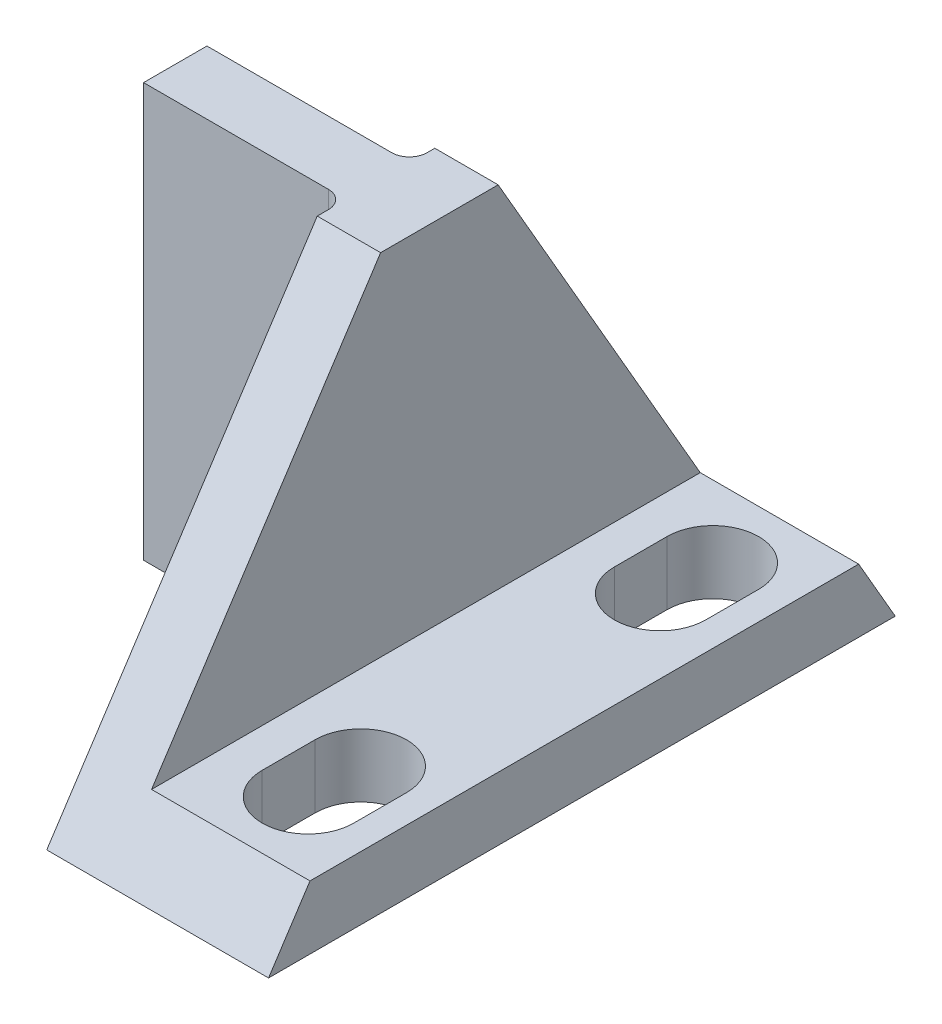
from build123d import *

# Parameters (mm, degrees)
SKETCH1_W           = 14.605
SKETCH1_H           = 33.02
BOSS_EXTRUDE1_DEPTH = 4.572
BOSS_EXTRUDE2_DEPTH = 4.572
BOSS_EXTRUDE3_DEPTH = 11.43
CUT_EXTRUDE1_DEPTH  = 50.300379278
SKETCH5_R           = 1.25000004
SKETCH5_R_2         = 1.25
CUT_EXTRUDE2_DEPTH  = 11.43
SKETCH6_W           = 33.355726526
SKETCH6_H           = 18.831890795
CUT_EXTRUDE3_DEPTH  = 3.175
FILLET1_R           = 1.27


with BuildPart() as part:
    # Sketch1 → Boss-Extrude1 (new body)
    with BuildSketch(Plane.XY):
        with Locations((7.3025, 16.51)):
            Rectangle(SKETCH1_W, SKETCH1_H)
    extrude(amount=BOSS_EXTRUDE1_DEPTH)

    # Sketch2 → Boss-Extrude2 (add)
    with BuildSketch(Plane(origin=(14.605, 0, 0), x_dir=(0, 0, -1), z_dir=(1, 0, 0))):
        Polygon((-4.572, 33.02), (-26.162, 0), (19.05, 0), (0, 33.02), align=None)
    extrude(amount=BOSS_EXTRUDE2_DEPTH)

    # Sketch3 → Boss-Extrude3 (add)
    with BuildSketch(Plane(origin=(19.177, 0, 0), x_dir=(0, 0, -1), z_dir=(1, 0, 0))):
        Polygon((-23.172615385, 4.572), (16.412307692, 4.572), (19.05, 0), (-26.162, 0), align=None)
    extrude(amount=BOSS_EXTRUDE3_DEPTH)

    # Sketch4 → Cut-Extrude1 (cut, through all)
    with BuildSketch(Plane(origin=(0, 4.572, 0), x_dir=(1, 0, 0), z_dir=(0, 1, 0))):
        with BuildLine():
            Line((28.575, 11.224846154), (28.575, 7.414846154))
            ThreePointArc((28.575, 7.414846154), (25.273, 4.112846154), (21.971, 7.414846154))
            Line((21.971, 7.414846154), (21.971, 11.224846154))
            ThreePointArc((21.971, 11.224846154), (25.273, 14.526846154), (28.575, 11.224846154))
        make_face()
        with BuildLine():
            Line((28.575, -14.175153846), (28.575, -17.985153846))
            ThreePointArc((28.575, -17.985153846), (25.273, -21.287153846), (21.971, -17.985153846))
            Line((21.971, -17.985153846), (21.971, -14.175153846))
            ThreePointArc((21.971, -14.175153846), (25.273, -10.873153846), (28.575, -14.175153846))
        make_face()
    extrude(amount=-CUT_EXTRUDE1_DEPTH, mode=Mode.SUBTRACT)

    # Sketch5 → Cut-Extrude2 (cut)
    with BuildSketch(Plane.ZY):
        with Locations((2.286, 26.67)):
            Circle(SKETCH5_R)
        with Locations((2.286, 13.97)):
            Circle(SKETCH5_R_2)
    extrude(amount=-CUT_EXTRUDE2_DEPTH, mode=Mode.SUBTRACT)

    # Sketch6 → Cut-Extrude3 (cut)
    with BuildSketch(Plane(origin=(0, 33.02, 0), x_dir=(1, 0, 0), z_dir=(0, 1, 0))):
        with Locations((16.677863263, -3.376077476)):
            Rectangle(SKETCH6_W, SKETCH6_H)
    extrude(amount=-CUT_EXTRUDE3_DEPTH, mode=Mode.SUBTRACT)

    # Fillet1
    fillet1_edges = [part.edges().sort_by_distance(p)[0] for p in [
        (14.605, 14.9225, 4.572),
        (14.605, 14.9225, 0),
    ]]
    fillet(fillet1_edges, radius=FILLET1_R)


solid = part.part
